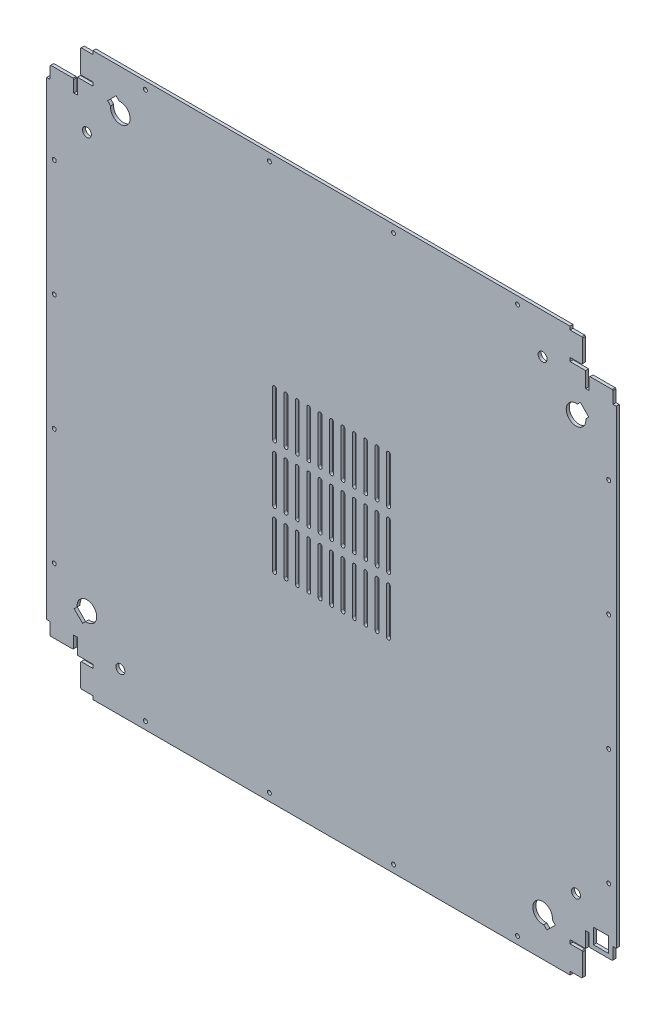
from build123d import *

# Parameters (mm, degrees)
SKETCH_1_W               = 750
SKETCH_1_H               = 740
EXTRUDE_1_DEPTH          = 4
SKETCH_11_R              = 2.6
CUT_EXTRUDE_4_DEPTH      = 527.821601683
CUT_EXTRUDE_3_DEPTH      = 527.821601683
SKETCH_5_R               = 5.9
CUT_EXTRUDE_1_DEPTH      = 527.821601683
PATTERN_CIRCULAR_2_COUNT = 2
PATTERN_CIRCULAR_2_ANGLE = 90
PATTERN_CIRCULAR_3_COUNT = 2
PATTERN_CIRCULAR_3_ANGLE = 90
PATTERN_CIRCULAR_4_COUNT = 2
SKETCH_12_W              = 20
SKETCH_12_H              = 20
CUT_EXTRUDE_5_DEPTH      = 527.821601683
CUT_EXTRUDE_7_DEPTH      = 527.821601683


with BuildPart() as part:
    # Эскиз1 → Бобышка-Вытянуть1 (new body)
    with BuildSketch(Plane.XY):
        Rectangle(SKETCH_1_W, SKETCH_1_H)
    extrude(amount=EXTRUDE_1_DEPTH)

    # Эскиз11 → Вырез-Вытянуть4 (cut, through all)
    with BuildSketch(Plane.XY.offset(4)):
        with Locations((-365, -240)):
            Circle(SKETCH_11_R)
        with Locations((-245, -360)):
            Circle(SKETCH_11_R)
        with Locations((-365, -86.67)):
            Circle(SKETCH_11_R)
        with Locations((-365, 66.66)):
            Circle(SKETCH_11_R)
        with Locations((-365, 219.99)):
            Circle(SKETCH_11_R)
        with Locations((-81.67, -360)):
            Circle(SKETCH_11_R)
        with Locations((81.66, -360)):
            Circle(SKETCH_11_R)
        with Locations((244.99, -360)):
            Circle(SKETCH_11_R)
        with Locations((365, 219.99)):
            Circle(SKETCH_11_R)
        with Locations((365, 66.66)):
            Circle(SKETCH_11_R)
        with Locations((365, -86.67)):
            Circle(SKETCH_11_R)
        with Locations((365, -240)):
            Circle(SKETCH_11_R)
        with Locations((-245, 360)):
            Circle(SKETCH_11_R)
        with Locations((-81.67, 360)):
            Circle(SKETCH_11_R)
        with Locations((81.66, 360)):
            Circle(SKETCH_11_R)
        with Locations((244.99, 360)):
            Circle(SKETCH_11_R)
    extrude(amount=-CUT_EXTRUDE_4_DEPTH, mode=Mode.SUBTRACT)

    # Эскиз9 → Вырез-Вытянуть3 (cut, through all)
    with BuildSketch(Plane.XY.offset(4)):
        Polygon((-375, -309.1), (-370.6, -309.1), (-370.6, -324.6), (-369.6, -325.6), (-340.4, -325.6), (-339.4, -324.6), (-339.4, -309.1), (-334.6, -309.1), (-334.6, -329.6), (-314.1, -329.6), (-314.1, -334.4), (-329.6, -334.4), (-330.6, -335.4), (-330.6, -364.6), (-329.6, -365.6), (-314.1, -365.6), (-314.1, -370), (-375, -370), align=None)
    cut_extrude_3 = extrude(amount=-CUT_EXTRUDE_3_DEPTH, mode=Mode.SUBTRACT)

    # Эскиз5 → Вырез-Вытянуть1 (cut, through all)
    with BuildSketch(Plane(origin=(0, 0, 0), x_dir=(-1, 0, 0), z_dir=(0, 0, -1))):
        with Locations((278, -317)):
            Circle(SKETCH_5_R)
        with BuildLine():
            Line((323.624958985, -285.797246122), (327.656854252, -289.829141389))
            Line((327.656854252, -289.829141389), (338.829141389, -278.656854252))
            Line((338.829141389, -278.656854252), (334.797246122, -274.624958985))
            ThreePointArc((334.797246122, -274.624958985), (312.878322523, -263.878322523), (323.624958985, -285.797246122))
        make_face()
    cut_extrude_1 = extrude(amount=-CUT_EXTRUDE_1_DEPTH, mode=Mode.SUBTRACT)

    # Круговой массив2: Вырез-Вытянуть3, Вырез-Вытянуть1 ×2 about axis
    pattern_circular_2_axis = Axis((0, 5, 4), (0, 0, 1))
    add([cut_extrude_3.rotate(pattern_circular_2_axis, i * PATTERN_CIRCULAR_2_ANGLE / (PATTERN_CIRCULAR_2_COUNT - 1)) for i in range(1, PATTERN_CIRCULAR_2_COUNT)], mode=Mode.SUBTRACT)
    add([cut_extrude_1.rotate(pattern_circular_2_axis, i * PATTERN_CIRCULAR_2_ANGLE / (PATTERN_CIRCULAR_2_COUNT - 1)) for i in range(1, PATTERN_CIRCULAR_2_COUNT)], mode=Mode.SUBTRACT)

    # Круговой массив3: Вырез-Вытянуть3, Вырез-Вытянуть1 ×2 about axis
    pattern_circular_3_axis = Axis((-5, 0, 4), (0, 0, -1))
    add([cut_extrude_3.rotate(pattern_circular_3_axis, i * PATTERN_CIRCULAR_3_ANGLE / (PATTERN_CIRCULAR_3_COUNT - 1)) for i in range(1, PATTERN_CIRCULAR_3_COUNT)], mode=Mode.SUBTRACT)
    add([cut_extrude_1.rotate(pattern_circular_3_axis, i * PATTERN_CIRCULAR_3_ANGLE / (PATTERN_CIRCULAR_3_COUNT - 1)) for i in range(1, PATTERN_CIRCULAR_3_COUNT)], mode=Mode.SUBTRACT)

    # Круговой массив4: Вырез-Вытянуть3, Вырез-Вытянуть1 ×2 about axis
    pattern_circular_4_axis = Axis((0, 0, 0), (0, 0, 1))
    add([cut_extrude_3.rotate(pattern_circular_4_axis, i * 360 / PATTERN_CIRCULAR_4_COUNT) for i in range(1, PATTERN_CIRCULAR_4_COUNT)], mode=Mode.SUBTRACT)
    add([cut_extrude_1.rotate(pattern_circular_4_axis, i * 360 / PATTERN_CIRCULAR_4_COUNT) for i in range(1, PATTERN_CIRCULAR_4_COUNT)], mode=Mode.SUBTRACT)

    # Эскиз12 → Вырез-Вытянуть5 (cut, through all)
    with BuildSketch(Plane.XY.offset(4)):
        with Locations((355, -310)):
            Rectangle(SKETCH_12_W, SKETCH_12_H)
    extrude(amount=-CUT_EXTRUDE_5_DEPTH, mode=Mode.SUBTRACT)

    # Эскиз15 → Вырез-Вытянуть7 (cut, through all)
    with BuildSketch(Plane(origin=(0, 0, 0), x_dir=(-1, 0, 0), z_dir=(0, 0, -1))):
        with BuildLine():
            Line((-72.5, -105), (-72.5, -45))
            ThreePointArc((-72.5, -45), (-75, -42.5), (-77.5, -45))
            Line((-77.5, -45), (-77.5, -105))
            ThreePointArc((-77.5, -105), (-75, -107.5), (-72.5, -105))
        make_face()
        with BuildLine():
            Line((-57.5, -105), (-57.5, -45))
            ThreePointArc((-57.5, -45), (-60, -42.5), (-62.5, -45))
            Line((-62.5, -45), (-62.5, -105))
            ThreePointArc((-62.5, -105), (-60, -107.5), (-57.5, -105))
        make_face()
        with BuildLine():
            Line((-42.5, -105), (-42.5, -45))
            ThreePointArc((-42.5, -45), (-45, -42.5), (-47.5, -45))
            Line((-47.5, -45), (-47.5, -105))
            ThreePointArc((-47.5, -105), (-45, -107.5), (-42.5, -105))
        make_face()
        with BuildLine():
            Line((-27.5, -105), (-27.5, -45))
            ThreePointArc((-27.5, -45), (-30, -42.5), (-32.5, -45))
            Line((-32.5, -45), (-32.5, -105))
            ThreePointArc((-32.5, -105), (-30, -107.5), (-27.5, -105))
        make_face()
        with BuildLine():
            Line((-12.5, -105), (-12.5, -45))
            ThreePointArc((-12.5, -45), (-15, -42.5), (-17.5, -45))
            Line((-17.5, -45), (-17.5, -105))
            ThreePointArc((-17.5, -105), (-15, -107.5), (-12.5, -105))
        make_face()
        with BuildLine():
            Line((2.5, -105), (2.5, -45))
            ThreePointArc((2.5, -45), (0, -42.5), (-2.5, -45))
            Line((-2.5, -45), (-2.5, -105))
            ThreePointArc((-2.5, -105), (0, -107.5), (2.5, -105))
        make_face()
        with BuildLine():
            Line((17.5, -105), (17.5, -45))
            ThreePointArc((17.5, -45), (15, -42.5), (12.5, -45))
            Line((12.5, -45), (12.5, -105))
            ThreePointArc((12.5, -105), (15, -107.5), (17.5, -105))
        make_face()
        with BuildLine():
            Line((32.5, -105), (32.5, -45))
            ThreePointArc((32.5, -45), (30, -42.5), (27.5, -45))
            Line((27.5, -45), (27.5, -105))
            ThreePointArc((27.5, -105), (30, -107.5), (32.5, -105))
        make_face()
        with BuildLine():
            Line((47.5, -105), (47.5, -45))
            ThreePointArc((47.5, -45), (45, -42.5), (42.5, -45))
            Line((42.5, -45), (42.5, -105))
            ThreePointArc((42.5, -105), (45, -107.5), (47.5, -105))
        make_face()
        with BuildLine():
            Line((62.5, -105), (62.5, -45))
            ThreePointArc((62.5, -45), (60, -42.5), (57.5, -45))
            Line((57.5, -45), (57.5, -105))
            ThreePointArc((57.5, -105), (60, -107.5), (62.5, -105))
        make_face()
        with BuildLine():
            Line((77.5, -105), (77.5, -45))
            ThreePointArc((77.5, -45), (75, -42.5), (72.5, -45))
            Line((72.5, -45), (72.5, -105))
            ThreePointArc((72.5, -105), (75, -107.5), (77.5, -105))
        make_face()
        with BuildLine():
            Line((-57.5, -30), (-57.5, 30))
            ThreePointArc((-57.5, 30), (-60, 32.5), (-62.5, 30))
            Line((-62.5, 30), (-62.5, -30))
            ThreePointArc((-62.5, -30), (-60, -32.5), (-57.5, -30))
        make_face()
        with BuildLine():
            Line((-42.5, -30), (-42.5, 30))
            ThreePointArc((-42.5, 30), (-45, 32.5), (-47.5, 30))
            Line((-47.5, 30), (-47.5, -30))
            ThreePointArc((-47.5, -30), (-45, -32.5), (-42.5, -30))
        make_face()
        with BuildLine():
            Line((-27.5, -30), (-27.5, 30))
            ThreePointArc((-27.5, 30), (-30, 32.5), (-32.5, 30))
            Line((-32.5, 30), (-32.5, -30))
            ThreePointArc((-32.5, -30), (-30, -32.5), (-27.5, -30))
        make_face()
        with BuildLine():
            Line((-12.5, -30), (-12.5, 30))
            ThreePointArc((-12.5, 30), (-15, 32.5), (-17.5, 30))
            Line((-17.5, 30), (-17.5, -30))
            ThreePointArc((-17.5, -30), (-15, -32.5), (-12.5, -30))
        make_face()
        with BuildLine():
            Line((2.5, -30), (2.5, 30))
            ThreePointArc((2.5, 30), (0, 32.5), (-2.5, 30))
            Line((-2.5, 30), (-2.5, -30))
            ThreePointArc((-2.5, -30), (0, -32.5), (2.5, -30))
        make_face()
        with BuildLine():
            Line((17.5, -30), (17.5, 30))
            ThreePointArc((17.5, 30), (15, 32.5), (12.5, 30))
            Line((12.5, 30), (12.5, -30))
            ThreePointArc((12.5, -30), (15, -32.5), (17.5, -30))
        make_face()
        with BuildLine():
            Line((32.5, -30), (32.5, 30))
            ThreePointArc((32.5, 30), (30, 32.5), (27.5, 30))
            Line((27.5, 30), (27.5, -30))
            ThreePointArc((27.5, -30), (30, -32.5), (32.5, -30))
        make_face()
        with BuildLine():
            Line((47.5, -30), (47.5, 30))
            ThreePointArc((47.5, 30), (45, 32.5), (42.5, 30))
            Line((42.5, 30), (42.5, -30))
            ThreePointArc((42.5, -30), (45, -32.5), (47.5, -30))
        make_face()
        with BuildLine():
            Line((62.5, -30), (62.5, 30))
            ThreePointArc((62.5, 30), (60, 32.5), (57.5, 30))
            Line((57.5, 30), (57.5, -30))
            ThreePointArc((57.5, -30), (60, -32.5), (62.5, -30))
        make_face()
        with BuildLine():
            Line((77.5, -30), (77.5, 30))
            ThreePointArc((77.5, 30), (75, 32.5), (72.5, 30))
            Line((72.5, 30), (72.5, -30))
            ThreePointArc((72.5, -30), (75, -32.5), (77.5, -30))
        make_face()
        with BuildLine():
            Line((-57.5, 45), (-57.5, 105))
            ThreePointArc((-57.5, 105), (-60, 107.5), (-62.5, 105))
            Line((-62.5, 105), (-62.5, 45))
            ThreePointArc((-62.5, 45), (-60, 42.5), (-57.5, 45))
        make_face()
        with BuildLine():
            Line((-42.5, 45), (-42.5, 105))
            ThreePointArc((-42.5, 105), (-45, 107.5), (-47.5, 105))
            Line((-47.5, 105), (-47.5, 45))
            ThreePointArc((-47.5, 45), (-45, 42.5), (-42.5, 45))
        make_face()
        with BuildLine():
            Line((-27.5, 45), (-27.5, 105))
            ThreePointArc((-27.5, 105), (-30, 107.5), (-32.5, 105))
            Line((-32.5, 105), (-32.5, 45))
            ThreePointArc((-32.5, 45), (-30, 42.5), (-27.5, 45))
        make_face()
        with BuildLine():
            Line((-12.5, 45), (-12.5, 105))
            ThreePointArc((-12.5, 105), (-15, 107.5), (-17.5, 105))
            Line((-17.5, 105), (-17.5, 45))
            ThreePointArc((-17.5, 45), (-15, 42.5), (-12.5, 45))
        make_face()
        with BuildLine():
            Line((2.5, 45), (2.5, 105))
            ThreePointArc((2.5, 105), (0, 107.5), (-2.5, 105))
            Line((-2.5, 105), (-2.5, 45))
            ThreePointArc((-2.5, 45), (0, 42.5), (2.5, 45))
        make_face()
        with BuildLine():
            Line((17.5, 45), (17.5, 105))
            ThreePointArc((17.5, 105), (15, 107.5), (12.5, 105))
            Line((12.5, 105), (12.5, 45))
            ThreePointArc((12.5, 45), (15, 42.5), (17.5, 45))
        make_face()
        with BuildLine():
            Line((32.5, 45), (32.5, 105))
            ThreePointArc((32.5, 105), (30, 107.5), (27.5, 105))
            Line((27.5, 105), (27.5, 45))
            ThreePointArc((27.5, 45), (30, 42.5), (32.5, 45))
        make_face()
        with BuildLine():
            Line((47.5, 45), (47.5, 105))
            ThreePointArc((47.5, 105), (45, 107.5), (42.5, 105))
            Line((42.5, 105), (42.5, 45))
            ThreePointArc((42.5, 45), (45, 42.5), (47.5, 45))
        make_face()
        with BuildLine():
            Line((62.5, 45), (62.5, 105))
            ThreePointArc((62.5, 105), (60, 107.5), (57.5, 105))
            Line((57.5, 105), (57.5, 45))
            ThreePointArc((57.5, 45), (60, 42.5), (62.5, 45))
        make_face()
        with BuildLine():
            Line((77.5, 45), (77.5, 105))
            ThreePointArc((77.5, 105), (75, 107.5), (72.5, 105))
            Line((72.5, 105), (72.5, 45))
            ThreePointArc((72.5, 45), (75, 42.5), (77.5, 45))
        make_face()
        with BuildLine():
            Line((-72.5, -30), (-72.5, 30))
            ThreePointArc((-72.5, 30), (-75, 32.5), (-77.5, 30))
            Line((-77.5, 30), (-77.5, -30))
            ThreePointArc((-77.5, -30), (-75, -32.5), (-72.5, -30))
        make_face()
        with BuildLine():
            Line((-72.5, 45), (-72.5, 105))
            ThreePointArc((-72.5, 105), (-75, 107.5), (-77.5, 105))
            Line((-77.5, 105), (-77.5, 45))
            ThreePointArc((-77.5, 45), (-75, 42.5), (-72.5, 45))
        make_face()
    extrude(amount=-CUT_EXTRUDE_7_DEPTH, mode=Mode.SUBTRACT)


solid = part.part
